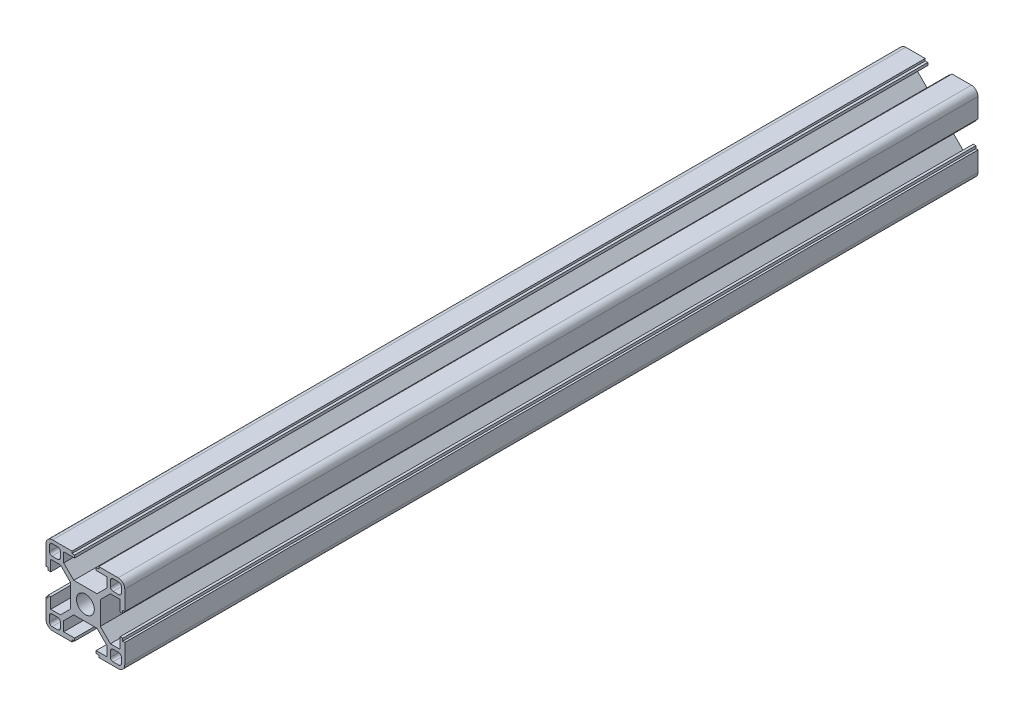
from build123d import *

# Parameters (mm, degrees)
SKETCH1_R      = 3.4
EXTRUDE1_DEPTH = 325
EXTRUDE2_DEPTH = 326.69157189


with BuildPart() as part:
    # Sketch1 → Extrude1 (new body)
    with BuildSketch(Plane.XY):
        with BuildLine():
            Line((-5.1, 14.2), (-5.1, 15))
            Line((-5.1, 15), (-12.5, 15))
            ThreePointArc((-12.5, 15), (-14.267766953, 14.267766953), (-15, 12.5))
            Line((-15, 12.5), (-15, 5.1))
            Line((-15, 5.1), (-14.2, 5.1))
            Line((-14.2, 5.1), (-14.2, 4.1))
            Line((-14.2, 4.1), (-13.2, 4.1))
            Line((-13.2, 4.1), (-13.2, 8.25))
            Line((-13.2, 8.25), (-9.522792206, 8.25))
            Line((-9.522792206, 8.25), (-5.7, 4.427207794))
            Line((-5.7, 4.427207794), (-5.7, -4.427207794))
            Line((-5.7, -4.427207794), (-9.522792206, -8.25))
            Line((-9.522792206, -8.25), (-13.2, -8.25))
            Line((-13.2, -8.25), (-13.2, -4.1))
            Line((-13.2, -4.1), (-14.2, -4.1))
            Line((-14.2, -4.1), (-14.2, -5.1))
            Line((-14.2, -5.1), (-15, -5.1))
            Line((-15, -5.1), (-15, -12.5))
            ThreePointArc((-15, -12.5), (-14.267766953, -14.267766953), (-12.5, -15))
            Line((-12.5, -15), (-5.1, -15))
            Line((-5.1, -15), (-5.1, -14.2))
            Line((-5.1, -14.2), (-4.1, -14.2))
            Line((-4.1, -14.2), (-4.1, -13.2))
            Line((-4.1, -13.2), (-8.25, -13.2))
            Line((-8.25, -13.2), (-8.25, -9.522792206))
            Line((-8.25, -9.522792206), (-4.427207794, -5.7))
            Line((-4.427207794, -5.7), (4.427207794, -5.7))
            Line((4.427207794, -5.7), (8.25, -9.522792206))
            Line((8.25, -9.522792206), (8.25, -13.2))
            Line((8.25, -13.2), (4.1, -13.2))
            Line((4.1, -13.2), (4.1, -14.2))
            Line((4.1, -14.2), (5.1, -14.2))
            Line((5.1, -14.2), (5.1, -15))
            Line((5.1, -15), (12.5, -15))
            ThreePointArc((12.5, -15), (14.267766953, -14.267766953), (15, -12.5))
            Line((15, -12.5), (15, -5.1))
            Line((15, -5.1), (14.2, -5.1))
            Line((14.2, -5.1), (14.2, -4.1))
            Line((14.2, -4.1), (13.2, -4.1))
            Line((13.2, -4.1), (13.2, -8.25))
            Line((13.2, -8.25), (9.522792206, -8.25))
            Line((9.522792206, -8.25), (5.7, -4.427207794))
            Line((5.7, -4.427207794), (5.7, 4.427207794))
            Line((5.7, 4.427207794), (9.522792206, 8.25))
            Line((9.522792206, 8.25), (13.2, 8.25))
            Line((13.2, 8.25), (13.2, 4.1))
            Line((13.2, 4.1), (14.2, 4.1))
            Line((14.2, 4.1), (14.2, 5.1))
            Line((14.2, 5.1), (15, 5.1))
            Line((15, 5.1), (15, 12.5))
            ThreePointArc((15, 12.5), (14.267766953, 14.267766953), (12.5, 15))
            Line((12.5, 15), (5.1, 15))
            Line((5.1, 15), (5.1, 14.2))
            Line((5.1, 14.2), (4.1, 14.2))
            Line((4.1, 14.2), (4.1, 13.2))
            Line((4.1, 13.2), (8.25, 13.2))
            Line((8.25, 13.2), (8.25, 9.522792206))
            Line((8.25, 9.522792206), (4.427207794, 5.7))
            Line((4.427207794, 5.7), (-4.427207794, 5.7))
            Line((-4.427207794, 5.7), (-8.25, 9.522792206))
            Line((-8.25, 9.522792206), (-8.25, 13.2))
            Line((-8.25, 13.2), (-4.1, 13.2))
            Line((-4.1, 13.2), (-4.1, 14.2))
            Line((-4.1, 14.2), (-5.1, 14.2))
        make_face()
        Circle(SKETCH1_R, mode=Mode.SUBTRACT)
    extrude(amount=EXTRUDE1_DEPTH)

    # Sketch2 → Extrude2 (cut, through all)
    with BuildSketch(Plane.XY.offset(325)):
        with BuildLine():
            Line((13.7, 12.7), (13.7, 10.55))
            ThreePointArc((13.7, 10.55), (13.407106781, 9.842893219), (12.7, 9.55))
            Line((12.7, 9.55), (10.55, 9.55))
            ThreePointArc((10.55, 9.55), (9.842893219, 9.842893219), (9.55, 10.55))
            Line((9.55, 10.55), (9.55, 12.7))
            ThreePointArc((9.55, 12.7), (9.842893219, 13.407106781), (10.55, 13.7))
            Line((10.55, 13.7), (12.7, 13.7))
            ThreePointArc((12.7, 13.7), (13.407106781, 13.407106781), (13.7, 12.7))
        make_face()
        with BuildLine():
            Line((-12.7, 13.7), (-10.55, 13.7))
            ThreePointArc((-10.55, 13.7), (-9.842893219, 13.407106781), (-9.55, 12.7))
            Line((-9.55, 12.7), (-9.55, 10.55))
            ThreePointArc((-9.55, 10.55), (-9.842893219, 9.842893219), (-10.55, 9.55))
            Line((-10.55, 9.55), (-12.7, 9.55))
            ThreePointArc((-12.7, 9.55), (-13.407106781, 9.842893219), (-13.7, 10.55))
            Line((-13.7, 10.55), (-13.7, 12.7))
            ThreePointArc((-13.7, 12.7), (-13.407106781, 13.407106781), (-12.7, 13.7))
        make_face()
        with BuildLine():
            Line((12.7, -13.7), (10.55, -13.7))
            ThreePointArc((10.55, -13.7), (9.842893219, -13.407106781), (9.55, -12.7))
            Line((9.55, -12.7), (9.55, -10.55))
            ThreePointArc((9.55, -10.55), (9.842893219, -9.842893219), (10.55, -9.55))
            Line((10.55, -9.55), (12.7, -9.55))
            ThreePointArc((12.7, -9.55), (13.407106781, -9.842893219), (13.7, -10.55))
            Line((13.7, -10.55), (13.7, -12.7))
            ThreePointArc((13.7, -12.7), (13.407106781, -13.407106781), (12.7, -13.7))
        make_face()
        with BuildLine():
            Line((-13.7, -12.7), (-13.7, -10.55))
            ThreePointArc((-13.7, -10.55), (-13.407106781, -9.842893219), (-12.7, -9.55))
            Line((-12.7, -9.55), (-10.55, -9.55))
            ThreePointArc((-10.55, -9.55), (-9.842893219, -9.842893219), (-9.55, -10.55))
            Line((-9.55, -10.55), (-9.55, -12.7))
            ThreePointArc((-9.55, -12.7), (-9.842893219, -13.407106781), (-10.55, -13.7))
            Line((-10.55, -13.7), (-12.7, -13.7))
            ThreePointArc((-12.7, -13.7), (-13.407106781, -13.407106781), (-13.7, -12.7))
        make_face()
    extrude(amount=-EXTRUDE2_DEPTH, mode=Mode.SUBTRACT)


solid = part.part
